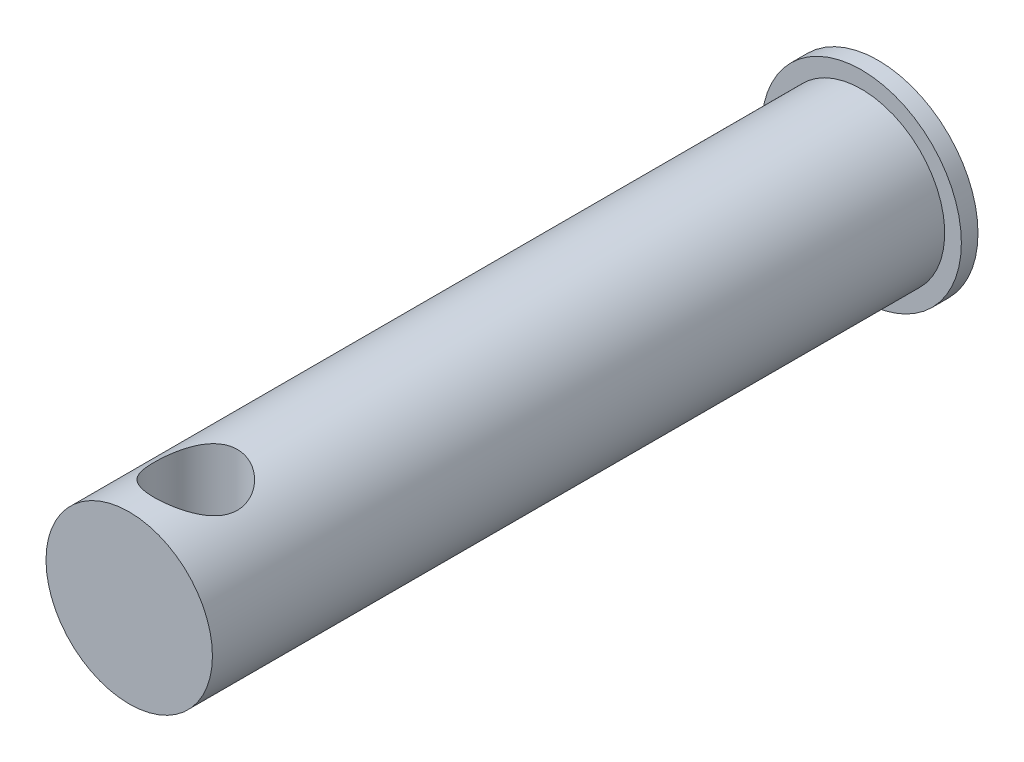
from build123d import *

# Parameters (mm, degrees)
SKETCH3_R           = 1.27
BOSS_EXTRUDE1_DEPTH = 5.715
SKETCH4_R           = 0.635
CUT_EXTRUDE1_DEPTH  = 1.524
BOSS_EXTRUDE2_START = -0.254
SKETCH5_R           = 1.524
SKETCH5_R_2         = 1.27
BOSS_EXTRUDE2_DEPTH = 0.254


with BuildPart() as part:
    # Sketch3 → Boss-Extrude1 (new, symmetric)
    with BuildSketch(Plane.XY):
        Circle(SKETCH3_R)
    extrude(amount=BOSS_EXTRUDE1_DEPTH, both=True)

    # Sketch4 → Cut-Extrude1 (cut, symmetric)
    with BuildSketch(Plane(origin=(0, 0, 0), x_dir=(1, 0, 0), z_dir=(0, 1, 0))):
        with Locations(Location((0, -4.699, 0), (0, 0, 270))):
            Circle(SKETCH4_R)
    extrude(amount=CUT_EXTRUDE1_DEPTH, both=True, mode=Mode.SUBTRACT)

    # Sketch5 → Boss-Extrude2 (add)
    with BuildSketch(Plane(origin=(0, 0, -5.715), x_dir=(-1, 0, 0), z_dir=(0, 0, -1)).offset(BOSS_EXTRUDE2_START)):
        Circle(SKETCH5_R)
        Circle(SKETCH5_R_2, mode=Mode.SUBTRACT)
    extrude(amount=BOSS_EXTRUDE2_DEPTH)


solid = part.part
